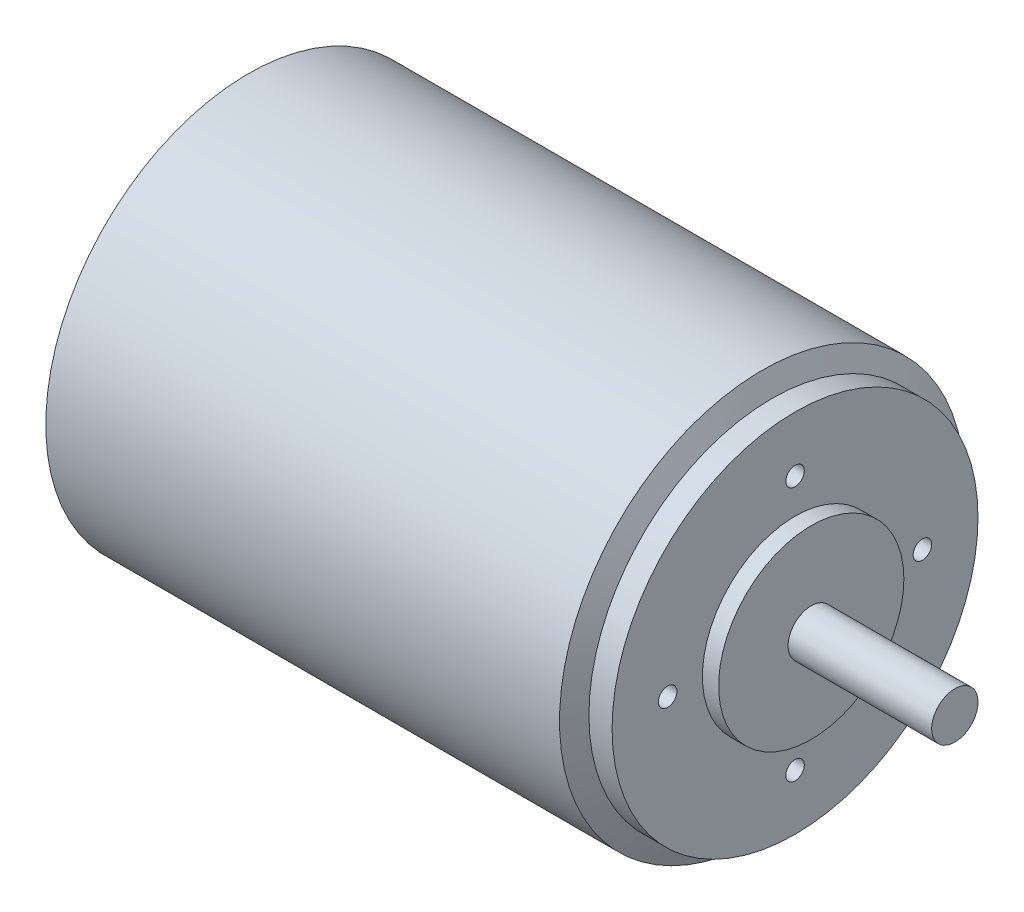
from build123d import *

# Parameters (mm, degrees)
R_P_TITION_CIRCULAIRE7_COUNT = 4


with BuildPart() as part:
    # Esquisse1 → Révolution1 (revolve)
    with BuildSketch(Plane(origin=(0, 0, 0), x_dir=(1, 0, 0), z_dir=(0, 1, 0))):
        Polygon((-18.460120385, 0), (-18.460120385, 2), (-12.160120385, 2), (-12.160120385, 7), (-8.660120385, 7), (-8.660120385, 17.5), (35.703488783, 17.5), (36.539879615, 15.8), (38.539879615, 15.8), (38.539879615, 8), (39.939879615, 8), (39.939879615, 2), (52.339879615, 2), (52.339879615, 0), align=None)
    revolve(axis=Axis((52.339879615, 0, 0), (-1, 0, 0)))

    # Esquisse4 → Trou taraudé M22 (revolve, cut)
    with BuildSketch(Plane(origin=(38.539879615, 0, -11), x_dir=(0, 0, -1), z_dir=(0, 1, 0))):
        Polygon((0, 0), (0, 5.180688495), (0.8, 4.7), (0.8, 0), align=None)
    trou_taraud_m22 = revolve(axis=Axis((44.889879615, 0, -11), (-1, 0, 0)), mode=Mode.SUBTRACT)

    # Répétition circulaire7: Trou taraudé M22 ×4 about axis
    r_p_tition_circulaire7_axis = Axis((0, 0, 0), (1, 0, 0))
    for i in range(1, R_P_TITION_CIRCULAIRE7_COUNT):
        add(trou_taraud_m22.rotate(r_p_tition_circulaire7_axis, i * 360 / R_P_TITION_CIRCULAIRE7_COUNT), mode=Mode.SUBTRACT)


solid = part.part
